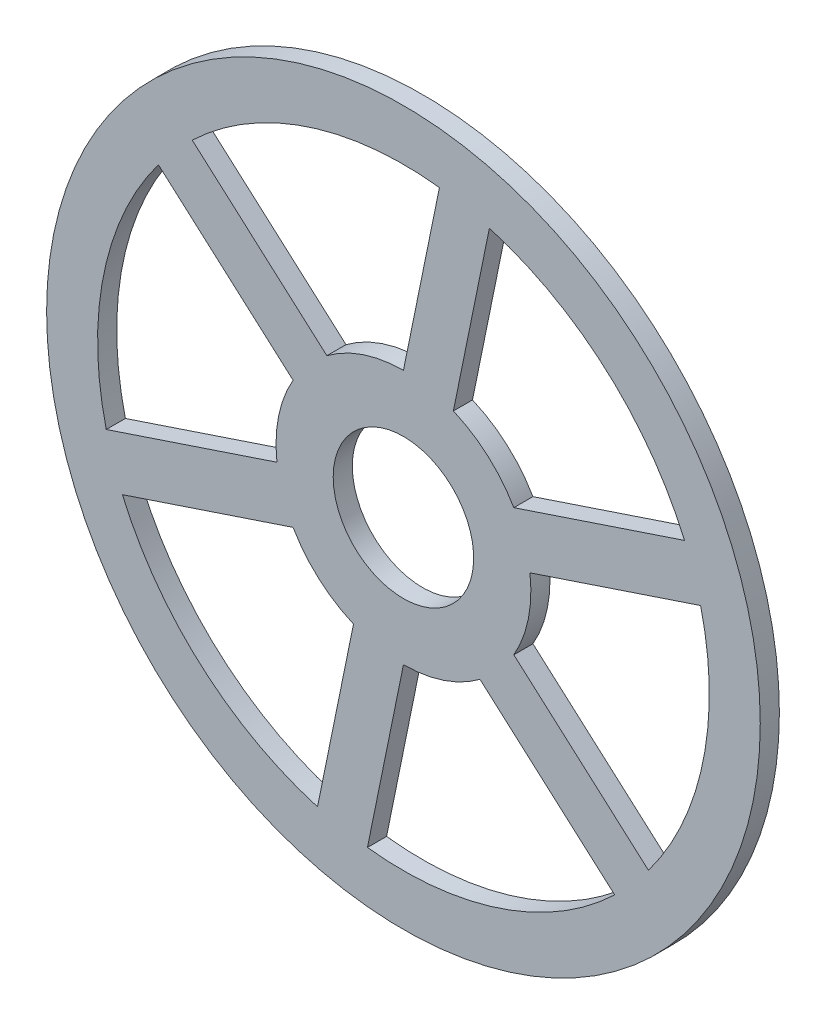
from build123d import *

# Parameters (mm, degrees)
SKETCH1_R           = 88.9
SKETCH1_R_2         = 17.5
BOSS_EXTRUDE1_DEPTH = 4.7625


with BuildPart() as part:
    # Sketch1 → Boss-Extrude1 (new body)
    with BuildSketch(Plane.XY):
        with Locations(Location((0, 0, 0), (0, 0, 180))):
            Circle(SKETCH1_R)
        with Locations(Location((0, 0, 0), (0, 0, 180))):
            Circle(SKETCH1_R_2, mode=Mode.SUBTRACT)
        with BuildLine():
            Line((8.965287197, 75.670758061), (0, 31.75))
            ThreePointArc((0, 31.75), (-10.054998553, 30.115768363), (-19.074898098, 25.381307345))
            Line((-19.074898098, 25.381307345), (-52.628746733, 55.10585284))
            ThreePointArc((-52.628746733, 55.10585284), (-24.131996526, 72.277844072), (8.965287197, 75.670758061))
        make_face(mode=Mode.SUBTRACT)
        with BuildLine():
            Line((70.015442403, 30.071212565), (27.49630657, 15.875))
            ThreePointArc((27.49630657, 15.875), (21.053521181, 23.765768363), (12.443407893, 29.21))
            Line((12.443407893, 29.21), (21.40869509, 73.130758061))
            ThreePointArc((21.40869509, 73.130758061), (50.528450834, 57.037844072), (70.015442403, 30.071212565))
        make_face(mode=Mode.SUBTRACT)
        with BuildLine():
            Line((61.050155206, -45.599545495), (27.49630657, -15.875))
            ThreePointArc((27.49630657, -15.875), (31.108519733, -6.35), (31.518305991, 3.828692655))
            Line((31.518305991, 3.828692655), (74.037441824, 18.02490522))
            ThreePointArc((74.037441824, 18.02490522), (74.66044736, -15.24), (61.050155206, -45.599545495))
        make_face(mode=Mode.SUBTRACT)
        with BuildLine():
            Line((-8.965287197, -75.670758061), (0, -31.75))
            ThreePointArc((0, -31.75), (10.054998553, -30.115768363), (19.074898098, -25.381307345))
            Line((19.074898098, -25.381307345), (52.628746733, -55.10585284))
            ThreePointArc((52.628746733, -55.10585284), (24.131996526, -72.277844072), (-8.965287197, -75.670758061))
        make_face(mode=Mode.SUBTRACT)
        with BuildLine():
            Line((-70.015442403, -30.071212565), (-27.49630657, -15.875))
            ThreePointArc((-27.49630657, -15.875), (-21.053521181, -23.765768363), (-12.443407893, -29.21))
            Line((-12.443407893, -29.21), (-21.40869509, -73.130758061))
            ThreePointArc((-21.40869509, -73.130758061), (-50.528450834, -57.037844072), (-70.015442403, -30.071212565))
        make_face(mode=Mode.SUBTRACT)
        with BuildLine():
            Line((-61.050155206, 45.599545495), (-27.49630657, 15.875))
            ThreePointArc((-27.49630657, 15.875), (-31.108519733, 6.35), (-31.518305991, -3.828692655))
            Line((-31.518305991, -3.828692655), (-74.037441824, -18.02490522))
            ThreePointArc((-74.037441824, -18.02490522), (-74.66044736, 15.24), (-61.050155206, 45.599545495))
        make_face(mode=Mode.SUBTRACT)
    extrude(amount=BOSS_EXTRUDE1_DEPTH)


solid = part.part
